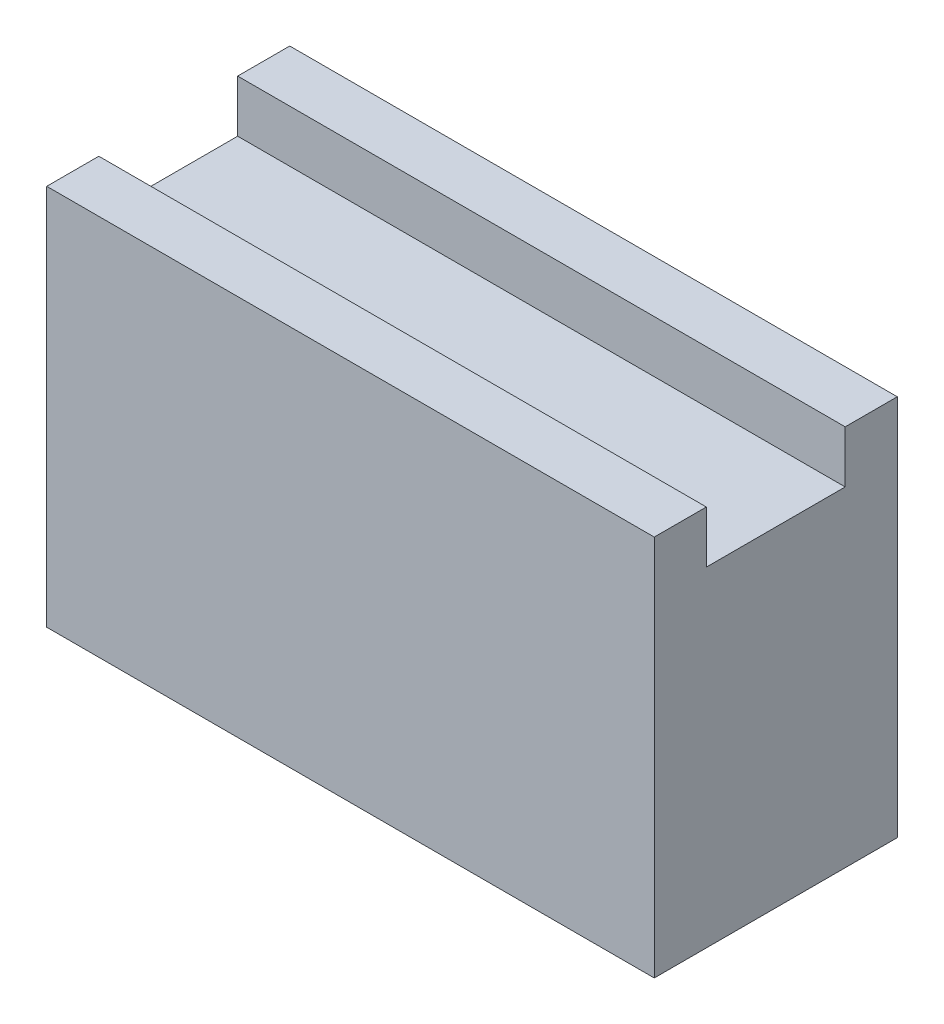
from build123d import *

# Parameters (mm, degrees)
BOSS_EXTRUDE1_DEPTH = 35


with BuildPart() as part:
    # Sketch1 → Boss-Extrude1 (new body)
    with BuildSketch(Plane(origin=(0, 0, 0), x_dir=(0, 0, -1), z_dir=(1, 0, 0))):
        Polygon((-7, 9.5), (-7, 12.5), (-4, 12.5), (-4, 9.5), (4, 9.5), (4, 12.5), (7, 12.5), (7, 9.5), (7, -9.5), (-7, -9.5), align=None)
    extrude(amount=-BOSS_EXTRUDE1_DEPTH)


solid = part.part
